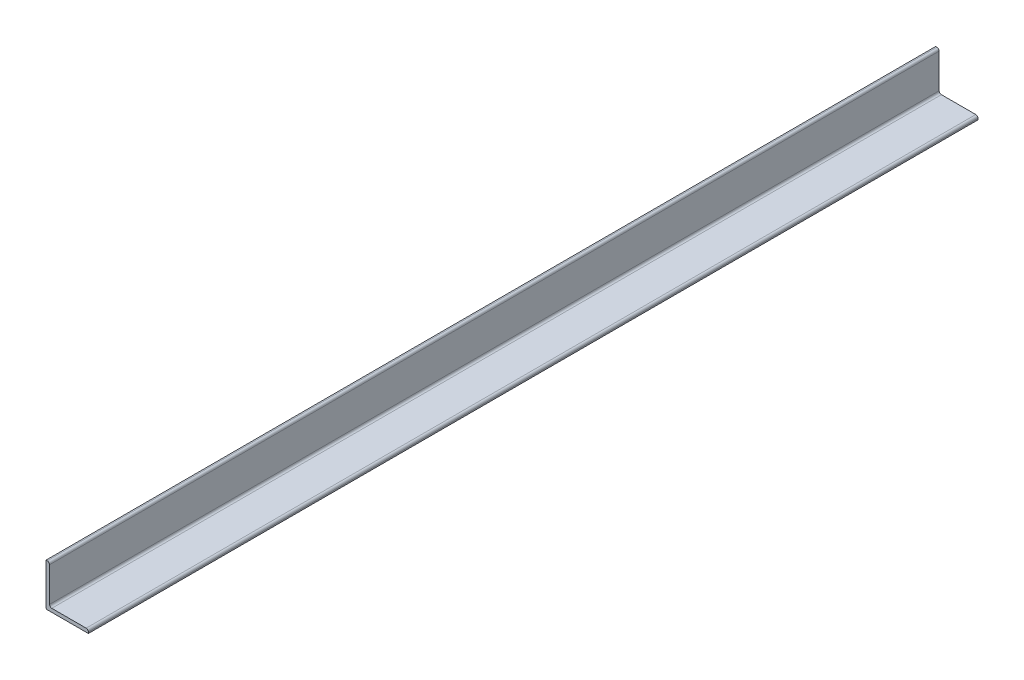
from build123d import *

# Parameters (mm, degrees)
BOSS_EXTRUDE1_DEPTH = 400
FILLET1_R           = 1
FILLET2_R           = 0.5


with BuildPart() as part:
    # Sketch1 → Boss-Extrude1 (new body)
    with BuildSketch(Plane.XY):
        Polygon((0, 0), (0, 19.05), (1.5875, 19.05), (1.5875, 1.5875), (19.05, 1.5875), (19.05, 0), align=None)
    extrude(amount=BOSS_EXTRUDE1_DEPTH)

    # Fillet1
    fillet1_edges = [part.edges().sort_by_distance(p)[0] for p in [
        (1.5875, 19.05, 200),
        (1.5875, 1.5875, 200),
        (19.05, 1.5875, 200),
    ]]
    fillet(fillet1_edges, radius=FILLET1_R)

    # Fillet2
    fillet2_edges = [part.edges().sort_by_distance(p)[0] for p in [
        (0, 0, 200),
    ]]
    fillet(fillet2_edges, radius=FILLET2_R)


solid = part.part
